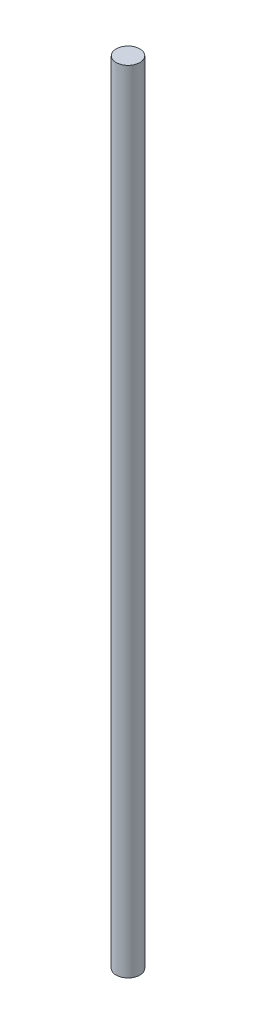
from build123d import *

# Parameters (mm, degrees)
SKETCH1_R           = 3
BOSS_EXTRUDE1_DEPTH = 200


with BuildPart() as part:
    # Sketch1 → Boss-Extrude1 (new body)
    with BuildSketch(Plane(origin=(0, 0, 0), x_dir=(1, 0, 0), z_dir=(0, 1, 0))):
        with Locations(Location((0, 0, 0), (0, 0, 270))):
            Circle(SKETCH1_R)
    extrude(amount=BOSS_EXTRUDE1_DEPTH)


solid = part.part
